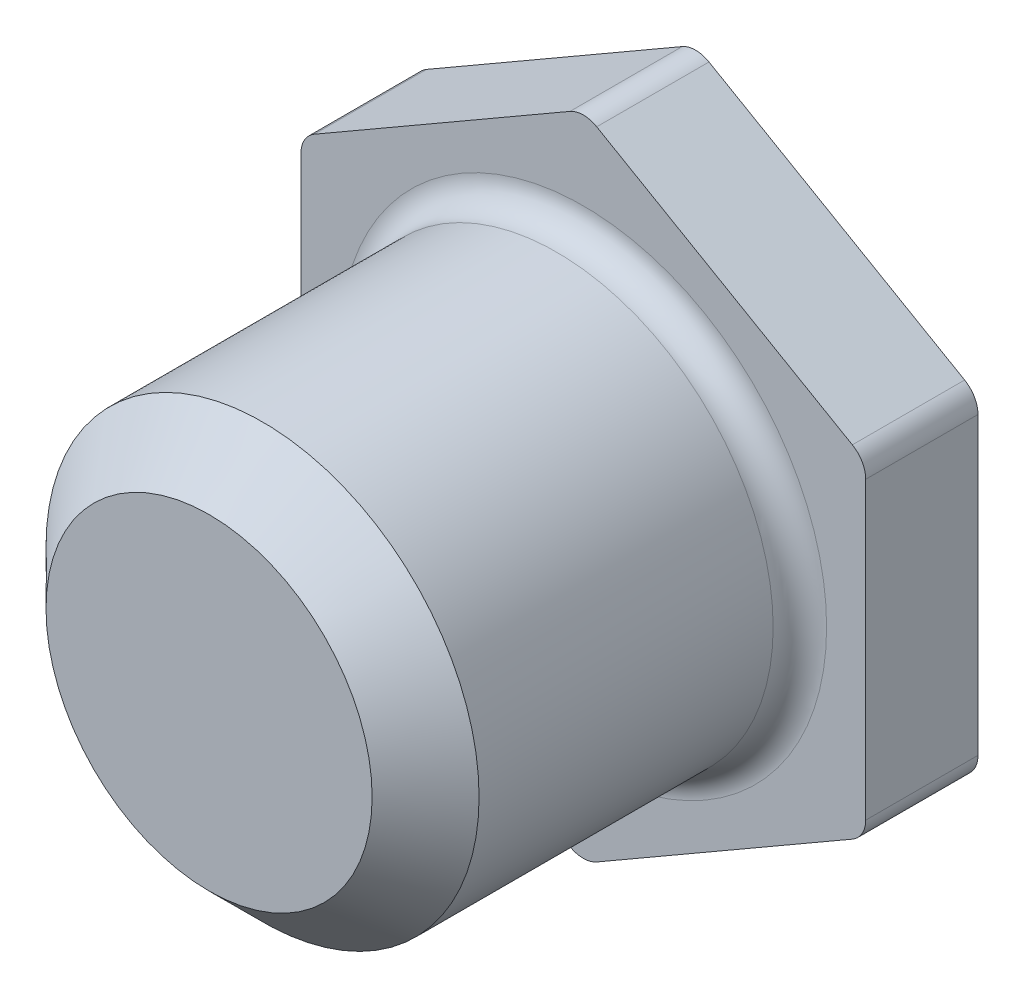
from build123d import *

# Parameters (mm, degrees)
BOSS_EXTRUDE1_DEPTH = 2.1
SKETCH2_R           = 4.05
BOSS_EXTRUDE2_DEPTH = 7
FILLET1_R           = 0.5
CHAMFER1_SIZE       = 1


with BuildPart() as part:
    # Sketch1 → Boss-Extrude1 (new body)
    with BuildSketch(Plane.XY):
        Polygon((5.281312122, 3.049166975), (0, 6.09833395), (-5.281312122, 3.049166975), (-5.281312122, -3.049166975), (0, -6.09833395), (5.281312122, -3.049166975), align=None)
    extrude(amount=BOSS_EXTRUDE1_DEPTH)

    # Sketch2 → Boss-Extrude2 (add)
    with BuildSketch(Plane.XY.offset(2.1)):
        Circle(SKETCH2_R)
    extrude(amount=BOSS_EXTRUDE2_DEPTH)

    # Fillet1
    fillet1_edges = [part.edges().sort_by_distance(p)[0] for p in [
        (5.281312122, -3.049166975, 1.05),
        (0, -6.09833395, 1.05),
        (-5.281312122, -3.049166975, 1.05),
        (-5.281312122, 3.049166975, 1.05),
        (0, 6.09833395, 1.05),
        (5.281312122, 3.049166975, 1.05),
        (-4.05, 0, 2.1),
    ]]
    fillet(fillet1_edges, radius=FILLET1_R)

    # Chamfer1
    chamfer1_edges = [part.edges().sort_by_distance(p)[0] for p in [
        (-4.05, 0, 9.1),
    ]]
    chamfer(chamfer1_edges, length=CHAMFER1_SIZE)


solid = part.part
